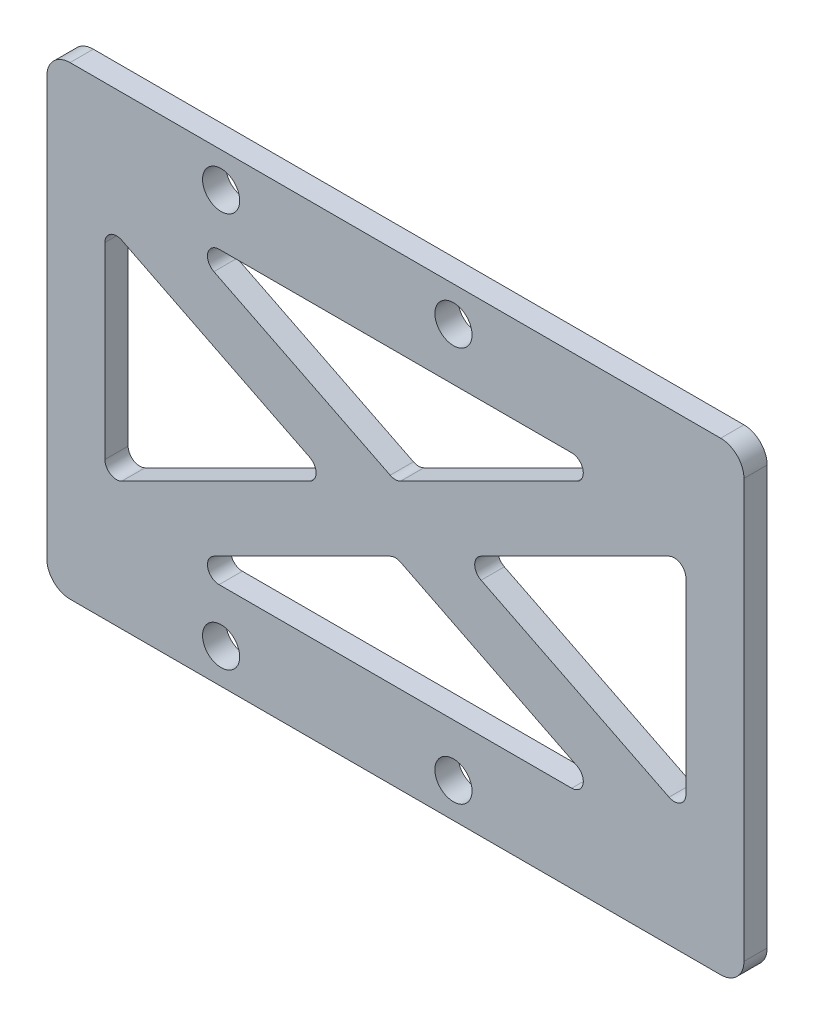
from build123d import *

# Parameters (mm, degrees)
SKETCH_1_W          = 60
SKETCH_1_H          = 40
EXTRUDE_1_DEPTH     = 2
FILLET_1_R          = 2
SKETCH_2_R          = 1.6
CUT_EXTRUDE_1_DEPTH = 37.110940171
CUT_EXTRUDE_2_DEPTH = 37.110940171
FILLET_2_R          = 1


with BuildPart() as part:
    # 草图1 → 凸台-拉伸1 (new body)
    with BuildSketch(Plane.XY):
        Rectangle(SKETCH_1_W, SKETCH_1_H)
    extrude(amount=EXTRUDE_1_DEPTH)

    # 圆角1
    fillet_1_edges = [part.edges().sort_by_distance(p)[0] for p in [
        (30, -20, 1),
        (-30, -20, 1),
        (-30, 20, 1),
        (30, 20, 1),
    ]]
    fillet(fillet_1_edges, radius=FILLET_1_R)

    # 草图2 → 切除-拉伸1 (cut, through all)
    with BuildSketch(Plane.XY.offset(2)):
        with Locations((-15, 17)):
            Circle(SKETCH_2_R)
        with Locations((5, 17)):
            Circle(SKETCH_2_R)
        with Locations((5, -17)):
            Circle(SKETCH_2_R)
        with Locations((-15, -17)):
            Circle(SKETCH_2_R)
    extrude(amount=-CUT_EXTRUDE_1_DEPTH, mode=Mode.SUBTRACT)

    # 草图3 → 切除-拉伸2 (cut, through all)
    with BuildSketch(Plane.XY.offset(2)):
        Polygon((-5.590169944, 0), (-25, 9.704915028), (-25, -9.704915028), align=None)
        Polygon((19.409830056, 12.5), (-19.409830056, 12.5), (0, 2.795084972), align=None)
        Polygon((19.409830056, -12.5), (0, -2.795084972), (-19.409830056, -12.5), align=None)
        Polygon((25, 9.704915028), (5.590169944, 0), (25, -9.704915028), align=None)
    extrude(amount=-CUT_EXTRUDE_2_DEPTH, mode=Mode.SUBTRACT)

    # 圆角2
    fillet_2_edges = [part.edges().sort_by_distance(p)[0] for p in [
        (0, 2.795084972, 1),
        (-19.409830056, 12.5, 1),
        (19.409830056, 12.5, 1),
        (-19.409830056, -12.5, 1),
        (0, -2.795084972, 1),
        (19.409830056, -12.5, 1),
        (5.590169944, 0, 1),
        (25, 9.704915028, 1),
        (25, -9.704915028, 1),
        (-25, -9.704915028, 1),
        (-25, 9.704915028, 1),
        (-5.590169944, 0, 1),
    ]]
    fillet(fillet_2_edges, radius=FILLET_2_R)


solid = part.part
